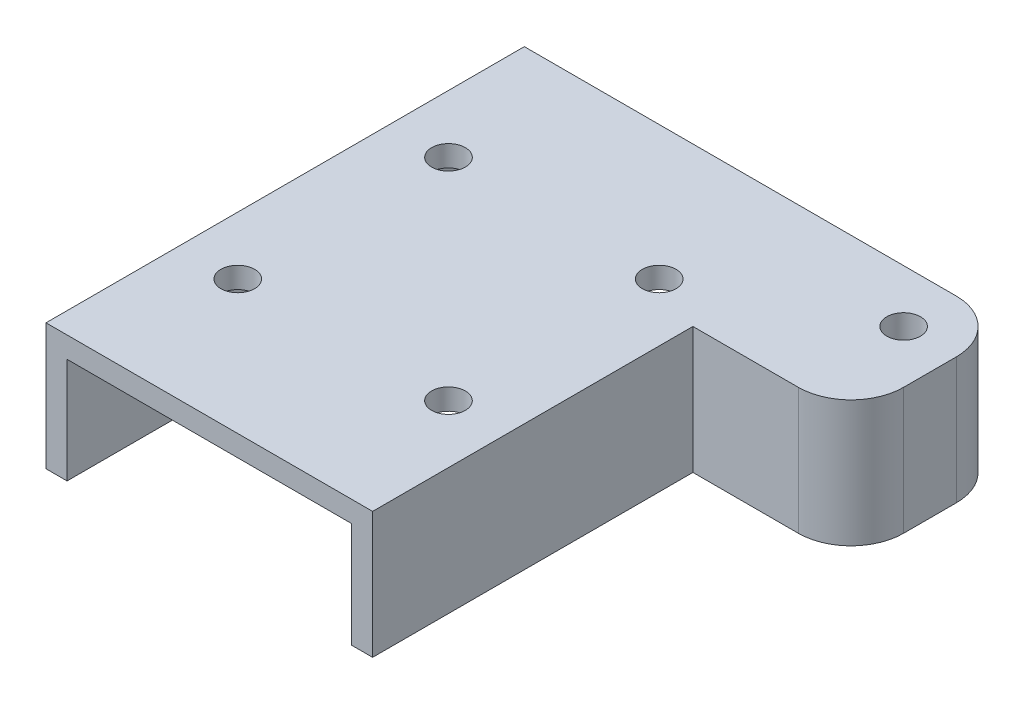
from build123d import *

# Parameters (mm, degrees)
SKETCH1_W           = 31
SKETCH1_H           = 45.4
BOSS_EXTRUDE1_DEPTH = 12
SKETCH2_W           = 27
SKETCH2_H           = 10
CUT_EXTRUDE1_DEPTH  = 57.268641356
SKETCH3_R           = 1.6
CUT_EXTRUDE2_DEPTH  = 10
SKETCH4_W           = 15
SKETCH4_H           = 12
BOSS_EXTRUDE2_DEPTH = 15
SKETCH5_R           = 1.6
CUT_EXTRUDE3_DEPTH  = 20
FILLET1_R           = 5


with BuildPart() as part:
    # Sketch1 → Boss-Extrude1 (new body)
    with BuildSketch(Plane(origin=(0, 0, 0), x_dir=(1, 0, 0), z_dir=(0, 1, 0))):
        with Locations((15.5, 22.7)):
            Rectangle(SKETCH1_W, SKETCH1_H)
    extrude(amount=BOSS_EXTRUDE1_DEPTH)

    # Sketch2 → Cut-Extrude1 (cut, through all)
    with BuildSketch(Plane.XY):
        with Locations((15.5, 5)):
            Rectangle(SKETCH2_W, SKETCH2_H)
    extrude(amount=-CUT_EXTRUDE1_DEPTH, mode=Mode.SUBTRACT)

    # Sketch3 → Cut-Extrude2 (cut)
    with BuildSketch(Plane(origin=(0, 12, 0), x_dir=(1, 0, 0), z_dir=(0, 1, 0))):
        with Locations(Location((5.5, 32.7, 0), (0, 0, 270))):
            Circle(SKETCH3_R)
        with Locations(Location((25.5, 32.7, 0), (0, 0, 270))):
            Circle(SKETCH3_R)
        with Locations(Location((25.5, 12.7, 0), (0, 0, 270))):
            Circle(SKETCH3_R)
        with Locations(Location((5.5, 12.7, 0), (0, 0, 270))):
            Circle(SKETCH3_R)
    extrude(amount=-CUT_EXTRUDE2_DEPTH, mode=Mode.SUBTRACT)

    # Sketch4 → Boss-Extrude2 (add)
    with BuildSketch(Plane.ZY):
        with Locations((-7.5, 6)):
            Rectangle(SKETCH4_W, SKETCH4_H)
    extrude(amount=BOSS_EXTRUDE2_DEPTH)

    # Sketch5 → Cut-Extrude3 (cut)
    with BuildSketch(Plane(origin=(0, 12, 0), x_dir=(1, 0, 0), z_dir=(0, 1, 0))):
        with Locations(Location((-10, 5, 0), (0, 0, 270))):
            Circle(SKETCH5_R)
    extrude(amount=-CUT_EXTRUDE3_DEPTH, mode=Mode.SUBTRACT)

    # Fillet1
    fillet1_edges = [part.edges().sort_by_distance(p)[0] for p in [
        (-15, 6, -15),
        (-15, 6, 0),
    ]]
    fillet(fillet1_edges, radius=FILLET1_R)


with BuildPart() as body_2:
    # Mirror2: mirrored copy
    add(part.part.mirror(Plane(origin=(31, 12, 0), x_dir=(0, 0, 1), z_dir=(-1, 0, 0))))


with BuildPart() as body_3:
    # Mirror3: mirrored copy
    add(body_2.part.mirror(Plane(origin=(62, 12, -45.4), x_dir=(1, 0, 0), z_dir=(0, 0, 1))))


solid = body_3.part
